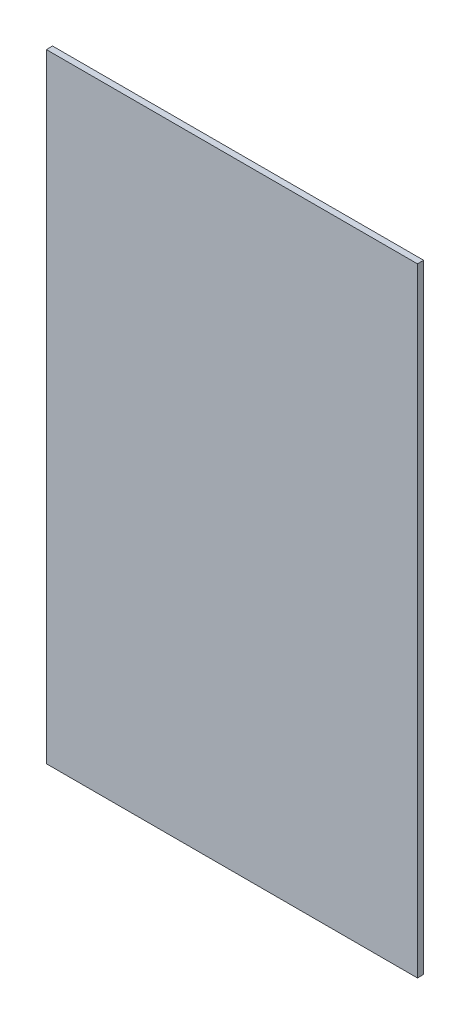
from build123d import *

# Parameters (mm, degrees)
SKETCH1_W           = 300
SKETCH1_H           = 500
BOSS_EXTRUDE1_DEPTH = 5


with BuildPart() as part:
    # Sketch1 → Boss-Extrude1 (new body)
    with BuildSketch(Plane.XY):
        Rectangle(SKETCH1_W, SKETCH1_H)
    extrude(amount=BOSS_EXTRUDE1_DEPTH)


solid = part.part
